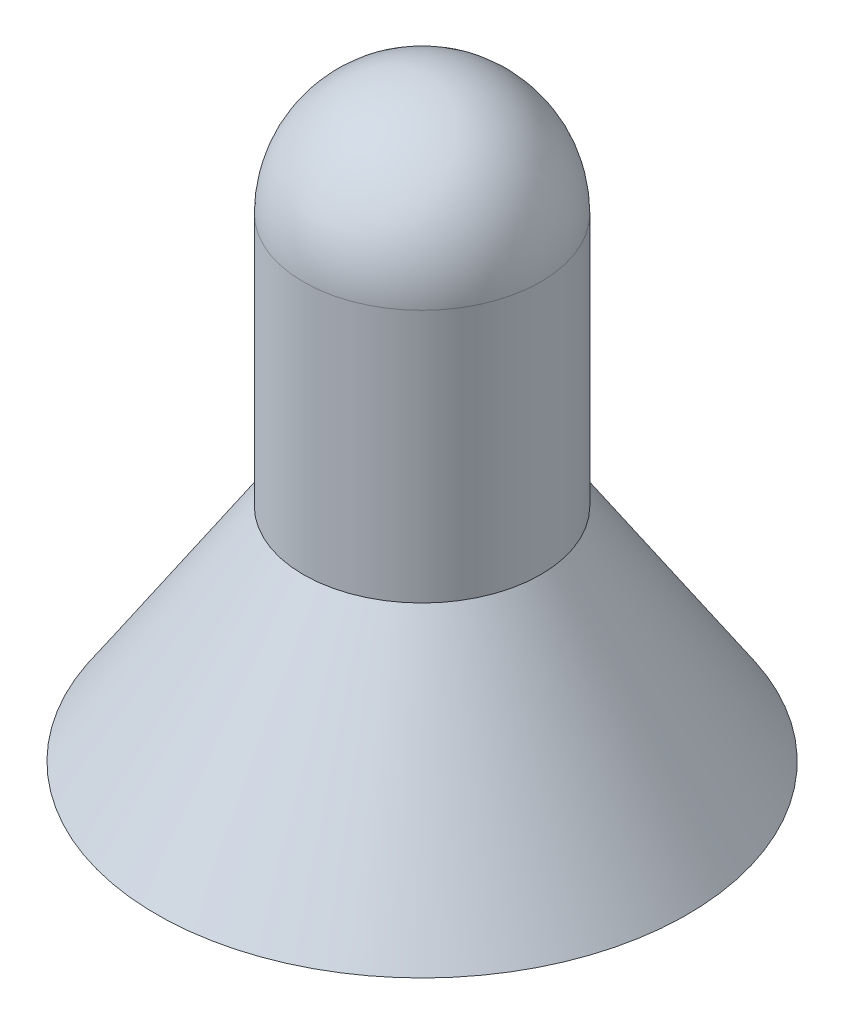
from build123d import *


with BuildPart() as part:
    # 草图1 → 旋转3 (revolve)
    with BuildSketch(Plane(origin=(0, 0, 0), x_dir=(0, 0, -1), z_dir=(1, 0, 0))):
        with BuildLine():
            Line((20, 37.266499161), (44.719798994, 0))
            Line((44.719798994, 0), (39.919798994, 0))
            Line((39.919798994, 0), (16.666666667, 35.055415968))
            ThreePointArc((16.666666667, 35.055415968), (9.457581103, 41.622546912), (0, 44))
            Line((0, 44), (0, 100))
            ThreePointArc((0, 100), (14.142135624, 94.142135624), (20, 80))
            Line((20, 80), (20, 37.266499161))
        make_face()
    revolve(axis=Axis((0, 44, 0), (0, 1, 0)))


solid = part.part
